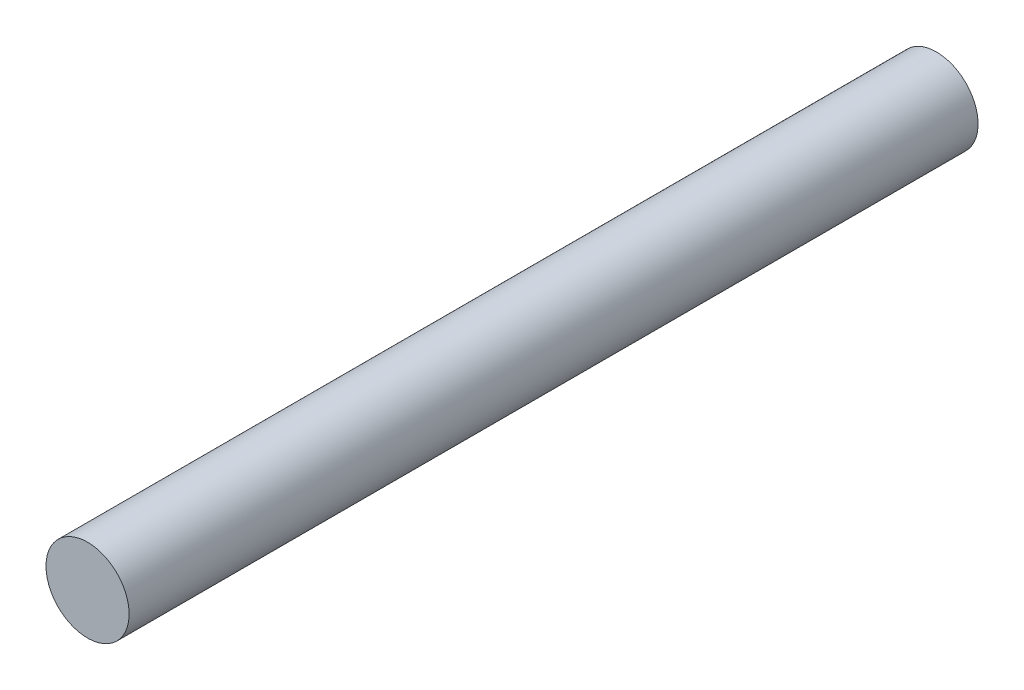
from build123d import *

# Parameters (mm, degrees)
SKETCH1_R           = 4.7625
BOSS_EXTRUDE1_DEPTH = 97.282


with BuildPart() as part:
    # Sketch1 → Boss-Extrude1 (new body)
    with BuildSketch(Plane.XY):
        with Locations(Location((0, 0, 0), (0, 0, 180))):
            Circle(SKETCH1_R)
    extrude(amount=BOSS_EXTRUDE1_DEPTH)


solid = part.part
